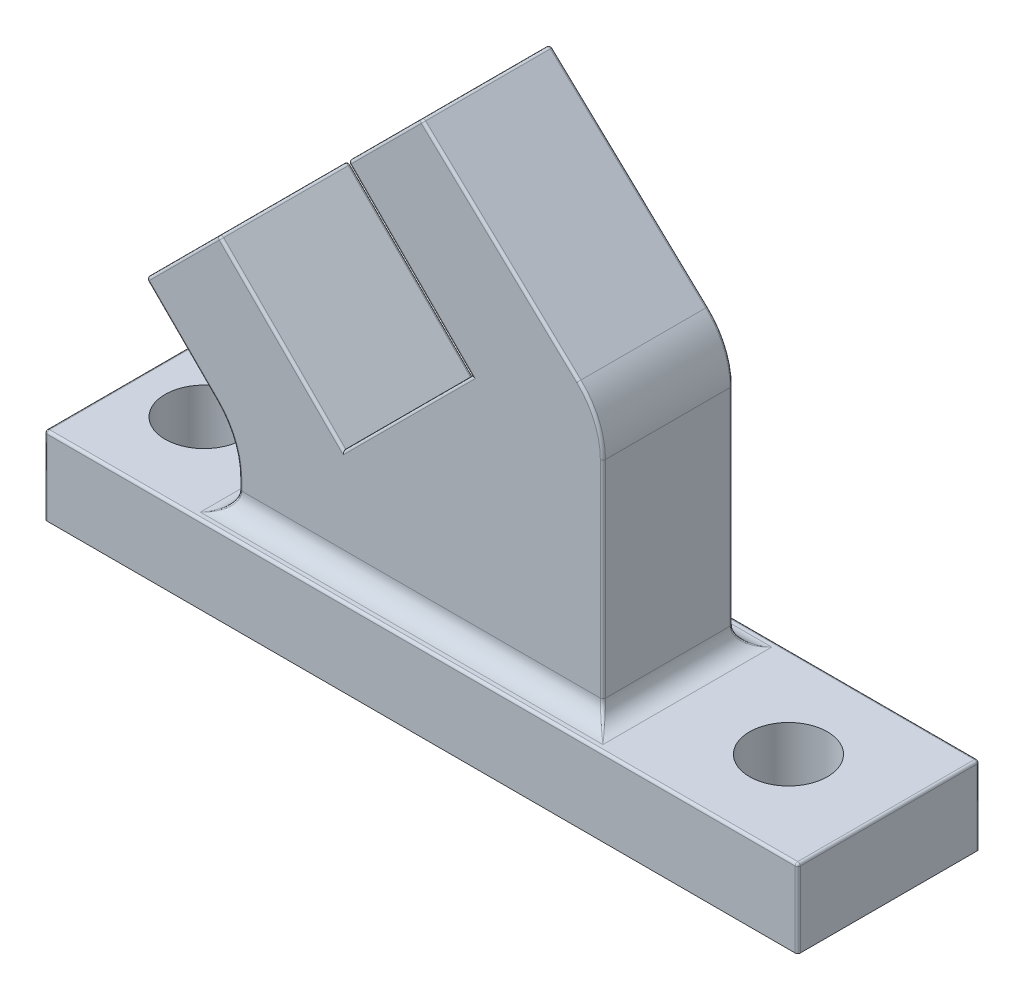
from build123d import *

# Parameters (mm, degrees)
SKETCH1_W                 = 58
SKETCH1_H                 = 14
SKETCH1_R                 = 3
BOSS_EXTRUDE1_DEPTH       = 6
BOSS_EXTRUDE2_DEPTH       = 5
M4X0_7_TAPPED_HOLE1_D     = 3.3
M4X0_7_TAPPED_HOLE1_DEPTH = 9
M4X0_7_TAPPED_HOLE1_TIP   = 0.991420021
FILLET1_R                 = 6
FILLET2_R                 = 1.5
FILLET3_R                 = 0.2


with BuildPart() as part:
    # Sketch1 → Boss-Extrude1 (new body)
    with BuildSketch(Plane(origin=(0, 0, 0), x_dir=(1, 0, 0), z_dir=(0, 1, 0))):
        Rectangle(SKETCH1_W, SKETCH1_H)
        with Locations(Location((-23.71, 0, 0), (0, 0, 270))):
            Circle(SKETCH1_R, mode=Mode.SUBTRACT)
        with Locations(Location((21.29, 0, 0), (0, 0, 270))):
            Circle(SKETCH1_R, mode=Mode.SUBTRACT)
    extrude(amount=BOSS_EXTRUDE1_DEPTH)

    # Sketch2 → Boss-Extrude2 (add, symmetric)
    with BuildSketch(Plane.XY):
        with BuildLine():
            Line((12, 26), (-1.98959236, 39.202795796))
            Line((-1.98959236, 39.202795796), (-7.646446609, 33.545941546))
            Line((-7.646446609, 33.545941546), (1.899494937, 24))
            Line((1.899494937, 24), (-8, 14.100505063))
            Line((-8, 14.100505063), (-17.545941546, 23.646446609))
            Line((-17.545941546, 23.646446609), (-23.202795796, 17.98959236))
            Line((-23.202795796, 17.98959236), (-17.757359313, 12.544155877))
            ThreePointArc((-17.757359313, 12.544155877), (-16.456722805, 10.597615784), (-16, 8.30151519))
            Line((-16, 8.30151519), (-16, 6))
            Line((-16, 6), (12, 6))
            Line((12, 6), (12, 26))
        make_face()
    extrude(amount=BOSS_EXTRUDE2_DEPTH, both=True)

    # M4x0.7 Tapped Hole1
    with Locations(Plane(origin=(-20.596194078, 20.596194078, 0), x_dir=(0.7071067811865507, 0.7071067811865445, 0), z_dir=(-0.7071067811865445, 0.7071067811865507, 0))):
        with Locations((-0.686291501, 0), (23.313708499, 0)):
            Hole(M4X0_7_TAPPED_HOLE1_D / 2, depth=M4X0_7_TAPPED_HOLE1_DEPTH)
            with Locations((0, 0, -(M4X0_7_TAPPED_HOLE1_DEPTH + M4X0_7_TAPPED_HOLE1_TIP / 2))):  # 118° drill point
                Cone(0, M4X0_7_TAPPED_HOLE1_D / 2, M4X0_7_TAPPED_HOLE1_TIP, mode=Mode.SUBTRACT)

    # Fillet1
    fillet1_edges = [part.edges().sort_by_distance(p)[0] for p in [
        (12, 26, 0),
    ]]
    fillet(fillet1_edges, radius=FILLET1_R)

    # Fillet2
    fillet2_edges = [part.edges().sort_by_distance(p)[0] for p in [
        (12, 6, 0),
        (-2, 6, -5),
        (-16, 6, 0),
        (-2, 6, 5),
    ]]
    fillet(fillet2_edges, radius=FILLET2_R)

    # Fillet3
    fillet3_edges = [part.edges().sort_by_distance(p)[0] for p in [
        (29, 6, 0),
        (0, 6, -7),
        (-4.818019485, 36.374368671, -5),
        (-1.98959236, 39.202795796, 0),
        (-2.873475836, 28.772970773, -5),
        (-7.646446609, 33.545941546, 0),
        (-3.050252532, 19.050252532, -5),
        (-12.772970773, 18.873475836, -5),
        (-20.374368671, 20.818019485, -5),
        (-17.545941546, 23.646446609, 0),
        (-20.480077554, 15.266874119, -5),
        (-23.202795796, 17.98959236, 0),
        (-16.456722805, 10.597615784, -5),
        (-16, 7.900757595, -5),
        (-4.818019485, 36.374368671, 5),
        (-2.873475836, 28.772970773, 5),
        (-3.050252532, 19.050252532, 5),
        (-12.772970773, 18.873475836, 5),
        (-20.374368671, 20.818019485, 5),
        (-20.480077554, 15.266874119, 5),
        (-16.456722805, 10.597615784, 5),
        (-16, 7.900757595, 5),
        (-29, 6, 0),
        (4.064283192, 33.489399677, -5),
        (4.064283192, 33.489399677, 5),
        (11.509489653, 25.788461743, -5),
        (11.509489653, 25.788461743, 5),
        (12, 15.456215324, -5),
        (12, 15.456215324, 5),
        (-16.530926639, 6.355055975, 5.530926639),
        (12.530926639, 6.355055975, 5.530926639),
        (-16.530926639, 6.355055975, -5.530926639),
        (12.530926639, 6.355055975, -5.530926639),
        (-29, 3, -7),
        (29, 3, -7),
        (29, 3, 7),
        (-29, 3, 7),
        (0, 6, 7),
    ]]
    fillet(fillet3_edges, radius=FILLET3_R)


solid = part.part
